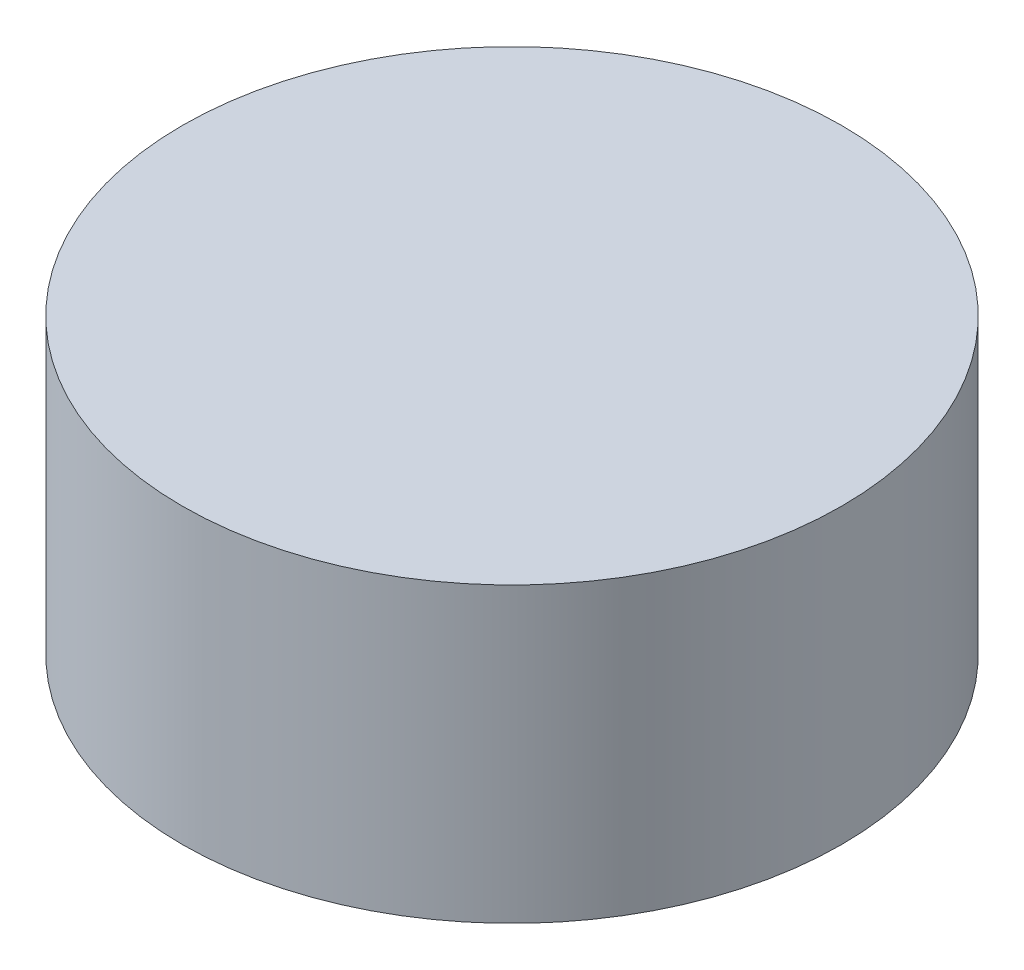
from build123d import *
from build123d.topology import SkipClean

# Parameters (mm, degrees)
SKETCH1_R           = 57.15
BOSS_EXTRUDE1_DEPTH = 50.8
CUT_EXTRUDE1_DEPTH  = 8.89
CUT_EXTRUDE3_START  = 6.985
CUT_EXTRUDE3_DEPTH  = 6.985
CUT_EXTRUDE5_START  = 3.81
CUT_EXTRUDE5_DEPTH  = 3.81


with BuildPart() as part:
    # Sketch1 → Boss-Extrude1 (new body)
    with BuildSketch(Plane(origin=(0, 0, 0), x_dir=(1, 0, 0), z_dir=(0, 1, 0))):
        with Locations(Location((0, 0, 0), (0, 0, 270))):
            Circle(SKETCH1_R)
    extrude(amount=BOSS_EXTRUDE1_DEPTH)

    # Sketch2 → Cut-Extrude1 (cut)
    with BuildSketch(Plane.XZ):
        with BuildLine():
            Line((55.749962332, 3.81), (50.656923515, 3.81))
            ThreePointArc((50.656923515, 3.81), (0, 50.8), (-50.656923515, 3.81))
            Line((-50.656923515, 3.81), (-55.749962332, 3.81))
            ThreePointArc((-55.749962332, 3.81), (-55.88, 0), (-55.749962332, -3.81))
            Line((-55.749962332, -3.81), (-50.656923515, -3.81))
            ThreePointArc((-50.656923515, -3.81), (0, -50.8), (50.656923515, -3.81))
            Line((50.656923515, -3.81), (55.749962332, -3.81))
            ThreePointArc((55.749962332, -3.81), (55.88, 0), (55.749962332, 3.81))
        make_face()
    extrude(amount=-CUT_EXTRUDE1_DEPTH, mode=Mode.SUBTRACT)

    # Sketch3 → Cut-Extrude3 (cut)
    with BuildSketch(Plane.XZ.offset(-8.89).offset(CUT_EXTRUDE3_START)):
        with BuildLine():
            Line((3.81, -55.749962332), (3.81, -50.656923515))
            ThreePointArc((3.81, -50.656923515), (0, -50.8), (-3.81, -50.656923515))
            Line((-3.81, -50.656923515), (-3.81, -55.749962332))
            ThreePointArc((-3.81, -55.749962332), (0, -55.88), (3.81, -55.749962332))
        make_face()
        with BuildLine():
            Line((-3.81, 55.749962332), (-3.81, 50.656923515))
            ThreePointArc((-3.81, 50.656923515), (0, 50.8), (3.81, 50.656923515))
            Line((3.81, 50.656923515), (3.81, 55.749962332))
            ThreePointArc((3.81, 55.749962332), (0, 55.88), (-3.81, 55.749962332))
        make_face()
    extrude(amount=-CUT_EXTRUDE3_DEPTH, mode=Mode.SUBTRACT)

    # Sketch4 → Cut-Extrude5 (cut)
    with SkipClean():  # the faces are left unmerged after this step: merging them gives an invalid solid
        with BuildSketch(Plane.XZ.offset(-8.89).offset(CUT_EXTRUDE5_START)):
            with BuildLine():
                Line((55.749962332, 3.81), (50.656923515, 3.81))
                ThreePointArc((50.656923515, 3.81), (35.921024484, 35.921024484), (3.81, 50.656923515))
                Line((3.81, 50.656923515), (3.81, 55.749962332))
                ThreePointArc((3.81, 55.749962332), (39.513126933, 39.513126933), (55.749962332, 3.81))
            make_face()
            with BuildLine():
                Line((-55.749962332, -3.81), (-50.656923515, -3.81))
                ThreePointArc((-50.656923515, -3.81), (-35.921024484, -35.921024484), (-3.81, -50.656923515))
                Line((-3.81, -50.656923515), (-3.81, -55.749962332))
                ThreePointArc((-3.81, -55.749962332), (-39.513126933, -39.513126933), (-55.749962332, -3.81))
            make_face()
        extrude(amount=-CUT_EXTRUDE5_DEPTH, mode=Mode.SUBTRACT)


solid = part.part
